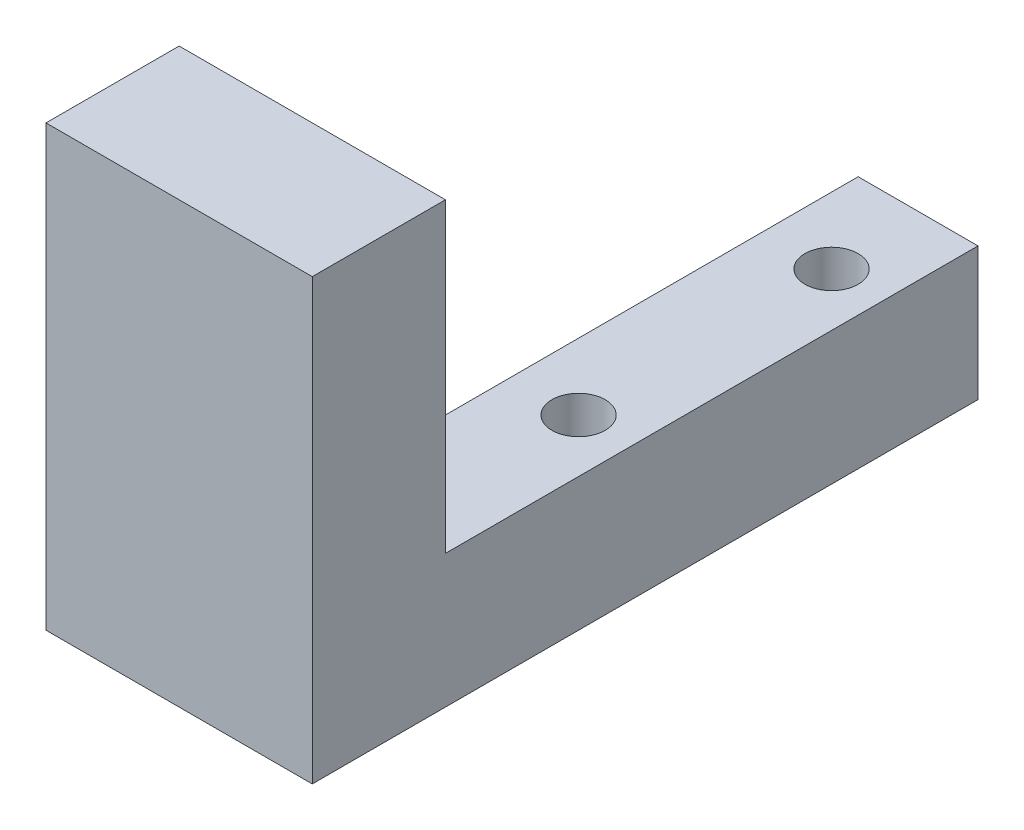
from build123d import *

# Parameters (mm, degrees)
SKETCH1_W           = 10
SKETCH1_H           = 10
BOSS_EXTRUDE1_DEPTH = 50
SKETCH3_W           = 10
SKETCH3_H           = 10
BOSS_EXTRUDE3_DEPTH = 11
SKETCH8_W           = 20
SKETCH8_H           = 10
BOSS_EXTRUDE4_DEPTH = 23
SKETCH9_R           = 2
CUT_EXTRUDE2_DEPTH  = 23
SKETCH9_4_R         = 2
CUT_EXTRUDE3_DEPTH  = 23
SKETCH_1_W          = 50
SKETCH_1_H          = 10
CUT_EXTRUDE_1_DEPTH = 1


with BuildPart() as part:
    # Sketch1 → Boss-Extrude1 (new body)
    with BuildSketch(Plane.XY):
        with Locations((-2.851282988, -1.356707317)):
            Rectangle(SKETCH1_W, SKETCH1_H)
    extrude(amount=BOSS_EXTRUDE1_DEPTH)

    # Sketch3 → Boss-Extrude3 (add)
    with BuildSketch(Plane.ZY.offset(7.851282988)):
        with Locations((45, -1.356707317)):
            Rectangle(SKETCH3_W, SKETCH3_H)
    extrude(amount=BOSS_EXTRUDE3_DEPTH)

    # Sketch8 → Boss-Extrude4 (add)
    with BuildSketch(Plane(origin=(0, 3.643292683, 0), x_dir=(1, 0, 0), z_dir=(0, 1, 0))):
        with Locations((-8.851282988, -45)):
            Rectangle(SKETCH8_W, SKETCH8_H)
    extrude(amount=BOSS_EXTRUDE4_DEPTH)

    # Sketch9 → Cut-Extrude2 (cut)
    with BuildSketch(Plane(origin=(0, 3.643292683, 0), x_dir=(1, 0, 0), z_dir=(0, 1, 0))):
        with Locations(Location((-2.851282988, -7, 0), (0, 0, 270))):
            Circle(SKETCH9_R)
    extrude(amount=-CUT_EXTRUDE2_DEPTH, mode=Mode.SUBTRACT)

    # Sketch9<4> → Cut-Extrude3 (cut)
    with BuildSketch(Plane(origin=(0, 3.643292683, 0), x_dir=(1, 0, 0), z_dir=(0, 1, 0))):
        with Locations(Location((-2.851282988, -26, 0), (0, 0, 270))):
            Circle(SKETCH9_4_R)
    extrude(amount=-CUT_EXTRUDE3_DEPTH, mode=Mode.SUBTRACT)

    # 草图1 → 切除-拉伸1 (cut)
    with BuildSketch(Plane(origin=(2.148717012, 0, 0), x_dir=(0, 0, -1), z_dir=(1, 0, 0))):
        with Locations((-25, -1.356707317)):
            Rectangle(SKETCH_1_W, SKETCH_1_H)
    extrude(amount=-CUT_EXTRUDE_1_DEPTH, mode=Mode.SUBTRACT)


solid = part.part
